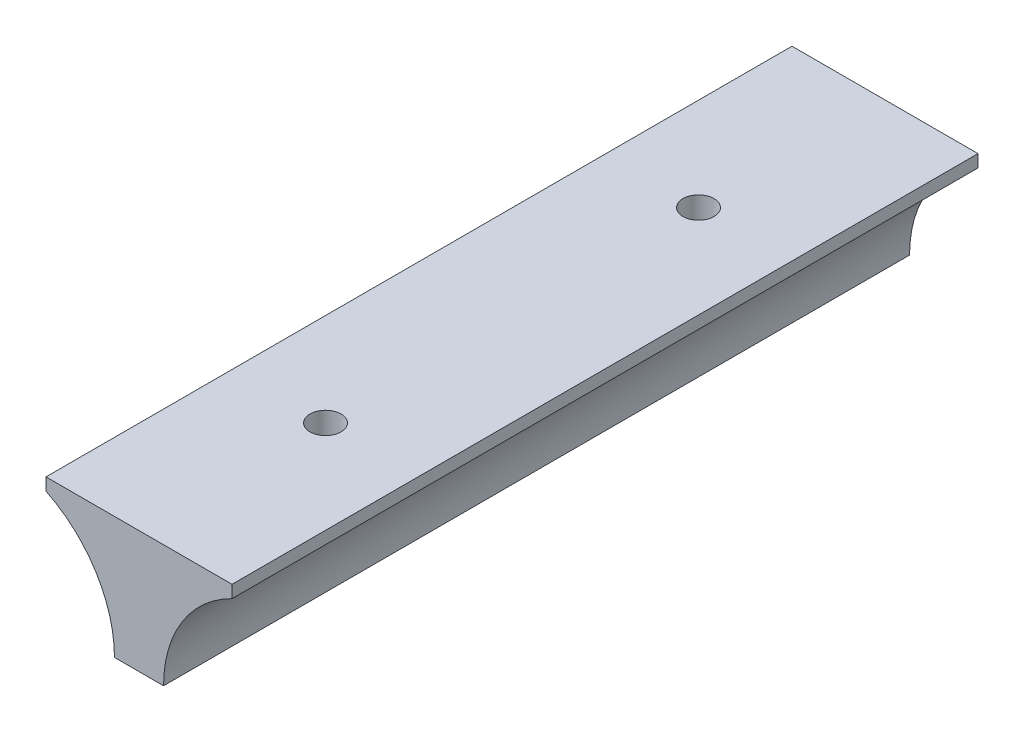
from build123d import *

# Parameters (mm, degrees)
BOSS_EXTRUDE1_DEPTH   = 60
F_2_5MM_DOWEL_HOLE1_D = 2.5


with BuildPart() as part:
    # Sketch1 → Boss-Extrude1 (new body)
    with BuildSketch(Plane.XY):
        with BuildLine():
            Line((-1.975, 0), (1.975, 0))
            ThreePointArc((1.975, 0), (3.464517951, 5.200996445), (7.481435424, 8.825))
            Line((7.481435424, 8.825), (7.481435424, 9.825))
            Line((7.481435424, 9.825), (-7.481435424, 9.825))
            Line((-7.481435424, 9.825), (-7.481435424, 8.825))
            ThreePointArc((-7.481435424, 8.825), (-3.464517951, 5.200996445), (-1.975, 0))
        make_face()
    extrude(amount=BOSS_EXTRUDE1_DEPTH)

    # Ø2.5mm Dowel Hole1 (through all)
    with Locations(Plane(origin=(0, 9.825, 45), x_dir=(0, 0, 1), z_dir=(0, 1, 0))):
        with Locations((0, 0), (-30, 0)):
            Hole(F_2_5MM_DOWEL_HOLE1_D / 2)


solid = part.part
